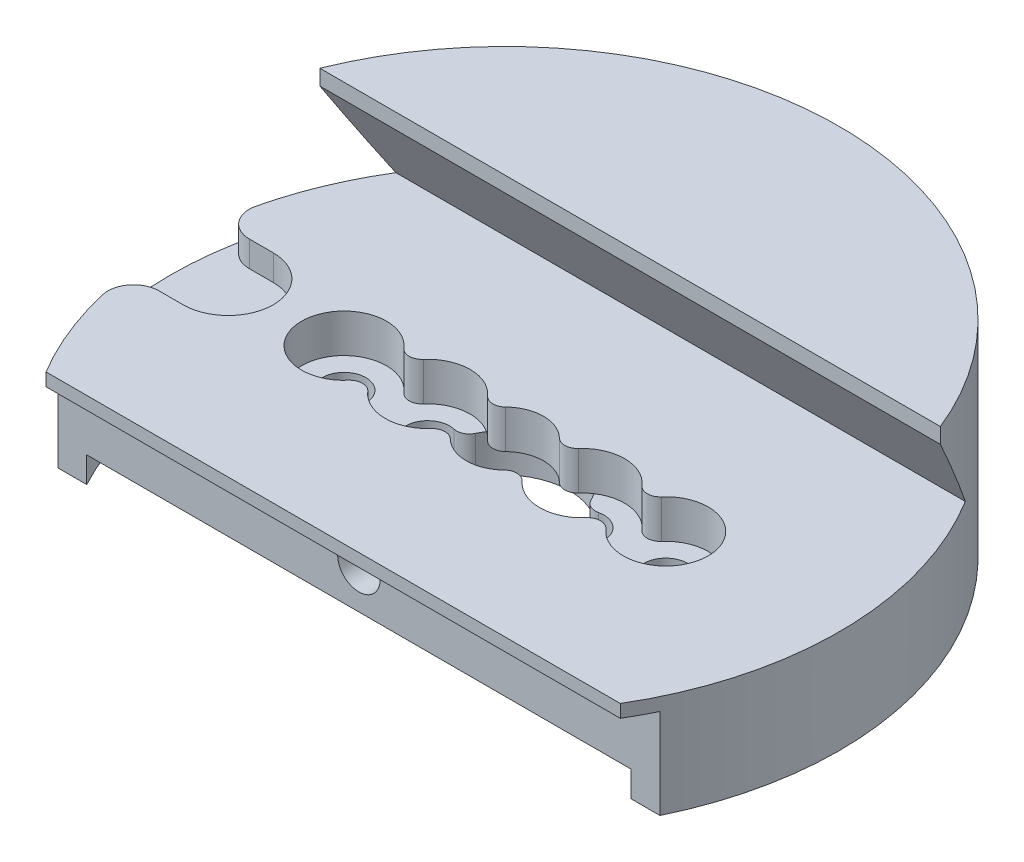
from build123d import *

# Parameters (mm, degrees)
SKETCH_1_R                  = 26
EXTRUDE_1_DEPTH             = 14
CUT_EXTRUDE_1_DEPTH         = 30
CUT_EXTRUDE_3_DEPTH         = 12
HOLE_WIZARD_M32_D           = 3.4
HOLE_WIZARD_M32_CBORE_D     = 6.6
HOLE_WIZARD_M32_CBORE_DEPTH = 3
EXTRUDE_START               = 2
SKETCH_12_R                 = 26
SKETCH_12_R_2               = 24
EXTRUDE_2_DEPTH             = 2
CUT_EXTRUDE_START           = -8
CUT_EXTRUDE_4_DEPTH         = 8
SKETCH_18_R                 = 5
CUT_EXTRUDE_5_DEPTH         = 3
CUT_EXTRUDE_START_2         = -10
CUT_EXTRUDE_6_DEPTH         = 10
M4X0_71_D                   = 3.3
M4X0_71_DEPTH               = 11.5
M4X0_71_TIP                 = 0.991420021
SKETCH_20_W                 = 50.531548996
SKETCH_20_H                 = 7
CUT_EXTRUDE_7_DEPTH         = 2
CUT_EXTRUDE_8_DEPTH         = 2
FILLET_3_R                  = 2
FILLET_4_R                  = 4
CUT_EXTRUDE_9_REACH         = 40.38
SKETCH_25_R                 = 3
FILLET_2_R                  = 1


with BuildPart() as part:
    # Эскиз1 → Бобышка-Вытянуть1 (new body)
    with BuildSketch(Plane(origin=(0, 0, 0), x_dir=(1, 0, 0), z_dir=(0, 1, 0))):
        with Locations(Location((0, 0, 0), (0, 0, 270))):
            Circle(SKETCH_1_R)
    extrude(amount=EXTRUDE_1_DEPTH)

    # Эскиз2 → Вырез-Вытянуть1 (cut, symmetric)
    with BuildSketch(Plane(origin=(0, 0, 0), x_dir=(0, 0, -1), z_dir=(1, 0, 0))):
        Polygon((13.654700538, 6), (-13.654700538, 6), (-9.728718708, 12.8), (-9.728718708, 14), (9.728718708, 14), (9.728718708, 12.8), align=None)
    extrude(amount=CUT_EXTRUDE_1_DEPTH, both=True, mode=Mode.SUBTRACT)

    # Эскиз5 → Вырез-Вытянуть3 (cut)
    with BuildSketch(Plane.XZ):
        with BuildLine():
            Line((-18.191491172, -15.654700538), (18.191491172, -15.654700538))
            ThreePointArc((18.191491172, -15.654700538), (0, -24), (-18.191491172, -15.654700538))
        make_face()
    extrude(amount=-CUT_EXTRUDE_3_DEPTH, mode=Mode.SUBTRACT)

    # Цековка для винта с внутренним шестигранником M32 (through all)
    with Locations(Plane(origin=(0, 6, 0), x_dir=(1, 0, 0), z_dir=(0, 1, 0))):
        with Locations((-12.5, 0), (12.5, 0), (-6, 0), (6, 0)):
            CounterBoreHole(HOLE_WIZARD_M32_D / 2, HOLE_WIZARD_M32_CBORE_D / 2, HOLE_WIZARD_M32_CBORE_DEPTH)

    # Эскиз12 → Бобышка-Вытянуть2 (add)
    with BuildSketch(Plane.XZ.offset(EXTRUDE_START)):
        with Locations(Location((0, 0, 0), (0, 0, 270))):
            Circle(SKETCH_12_R)
        with Locations(Location((0, 0, 0), (0, 0, 270))):
            Circle(SKETCH_12_R_2, mode=Mode.SUBTRACT)
    extrude(amount=-EXTRUDE_2_DEPTH)

    # Эскиз17 → Вырез-Вытянуть4 (cut)
    with BuildSketch(Plane(origin=(0, 14, 0), x_dir=(1, 0, 0), z_dir=(0, 1, 0)).offset(CUT_EXTRUDE_START)):
        with BuildLine():
            Line((-24.111242861, -9.728718708), (24.111242861, -9.728718708))
            ThreePointArc((24.111242861, -9.728718708), (0, -26), (-24.111242861, -9.728718708))
        make_face()
    extrude(amount=CUT_EXTRUDE_4_DEPTH, mode=Mode.SUBTRACT)

    # Эскиз18 → Вырез-Вытянуть5 (cut)
    with BuildSketch(Plane.XZ):
        Circle(SKETCH_18_R)
    extrude(amount=-CUT_EXTRUDE_5_DEPTH, mode=Mode.SUBTRACT)

    # Эскиз19 → Вырез-Вытянуть6 (cut)
    with BuildSketch(Plane(origin=(0, 6, 0), x_dir=(1, 0, 0), z_dir=(0, 1, 0)).offset(CUT_EXTRUDE_START_2)):
        with BuildLine():
            Line((-22.313739765, -13.345299462), (22.313739765, -13.345299462))
            ThreePointArc((22.313739765, -13.345299462), (0, -26), (-22.313739765, -13.345299462))
        make_face()
    extrude(amount=CUT_EXTRUDE_6_DEPTH, mode=Mode.SUBTRACT)

    # Отверстие обработанное метчиком M4x0.71
    with Locations(Plane.XY.offset(13.345299462)):
        with Locations((0, 3)):
            Hole(M4X0_71_D / 2, depth=M4X0_71_DEPTH)
            with Locations((0, 0, -(M4X0_71_DEPTH + M4X0_71_TIP / 2))):  # 118° drill point
                Cone(0, M4X0_71_D / 2, M4X0_71_TIP, mode=Mode.SUBTRACT)

    # Эскиз20 → Вырез-Вытянуть7 (cut)
    with BuildSketch(Plane.XY.offset(13.345299462)):
        with Locations((0, 1.5)):
            Rectangle(SKETCH_20_W, SKETCH_20_H)
    extrude(amount=-CUT_EXTRUDE_7_DEPTH, mode=Mode.SUBTRACT)

    # Эскиз24 → Вырез-Вытянуть8 (cut)
    with BuildSketch(Plane(origin=(0, 6, 0), x_dir=(1, 0, 0), z_dir=(0, 1, 0))):
        with BuildLine():
            Line((-30.5, 3.5), (-21.5, 3.5))
            ThreePointArc((-21.5, 3.5), (-18, 0), (-21.5, -3.5))
            Line((-21.5, -3.5), (-30.5, -3.5))
            ThreePointArc((-30.5, -3.5), (-34, 0), (-30.5, 3.5))
        make_face()
    extrude(amount=-CUT_EXTRUDE_8_DEPTH, mode=Mode.SUBTRACT)

    # Скругление3
    fillet_3_edges = [part.edges().sort_by_distance(p)[0] for p in [
        (-25.763346056, 5, 3.5),
        (-25.763346056, 5, -3.5),
    ]]
    fillet(fillet_3_edges, radius=FILLET_3_R)

    # Скругление4
    fillet_4_edges = [part.edges().sort_by_distance(p)[0] for p in [
        (18.191491172, 6, -15.654700538),
        (-18.191491172, 6, -15.654700538),
    ]]
    fillet(fillet_4_edges, radius=FILLET_4_R)

    # Эскиз25 → Вырез-Вытянуть9 (cut, up to next)
    with BuildSketch(Plane.XZ.offset(-3), mode=Mode.PRIVATE) as cut_extrude_9_sk1:
        Circle(SKETCH_25_R)
    cut_extrude_9_tool1 = extrude(cut_extrude_9_sk1.sketch, amount=-CUT_EXTRUDE_9_REACH, mode=Mode.PRIVATE) & part.part
    add(cut_extrude_9_tool1.solids().sort_by_distance((0, 3, 0))[0], mode=Mode.SUBTRACT)

    # Скругление2
    fillet_2_edges = [part.edges().sort_by_distance(p)[0] for p in [
        (4.8425, 1.5, 1.245067769),
        (-4.8425, 1.5, 1.245067769),
        (4.8425, 1.5, -1.245067769),
        (-4.8425, 1.5, -1.245067769),
        (2.8425, 4.5, 0.959267299),
        (2.8425, 4.5, -0.959267299),
        (-2.8425, 4.5, -0.959267299),
        (-2.8425, 4.5, 0.959267299),
        (9.25, 4.5, -0.572276157),
        (9.25, 4.5, 0.572276157),
        (-9.25, 4.5, 0.572276157),
        (-9.25, 4.5, -0.572276157),
    ]]
    fillet(fillet_2_edges, radius=FILLET_2_R)


solid = part.part
